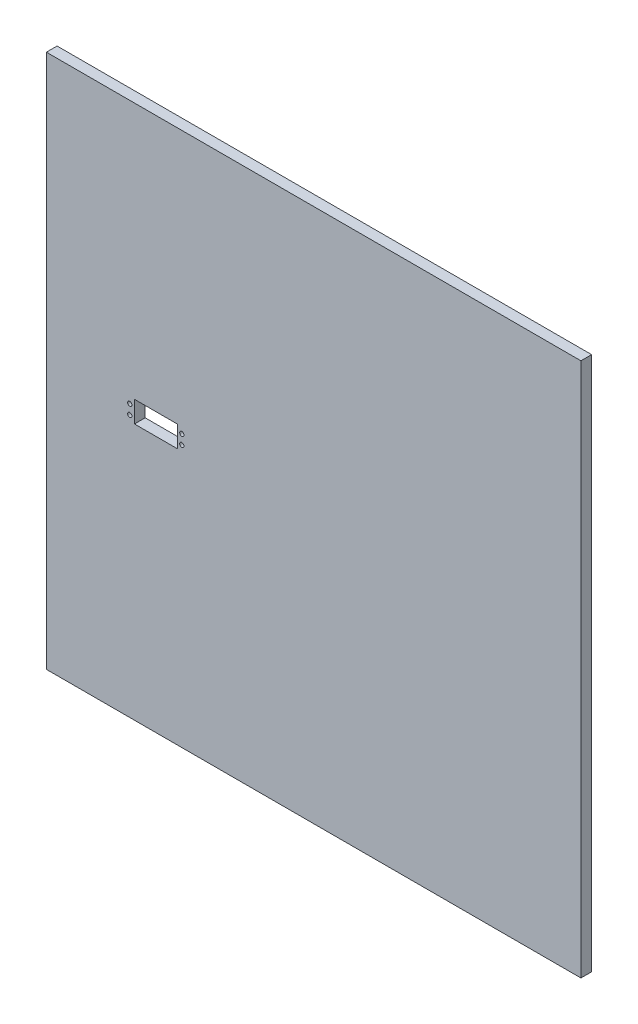
from build123d import *

# Parameters (mm, degrees)
CROQUIS1_W              = 500
CROQUIS1_H              = 500
CROQUIS1_R              = 2
CROQUIS1_W_2            = 40.3
CROQUIS1_H_2            = 20
SALIENTE_EXTRUIR1_DEPTH = 10


with BuildPart() as part:
    # Croquis1 → Saliente-Extruir1 (new body)
    with BuildSketch(Plane.XY):
        Rectangle(CROQUIS1_W, CROQUIS1_H)
        with Locations((-172.019654713, -4.841914395)):
            Circle(CROQUIS1_R, mode=Mode.SUBTRACT)
        with Locations((-172.019654713, 4.158085605)):
            Circle(CROQUIS1_R, mode=Mode.SUBTRACT)
        with Locations((-123.313117324, 4.158085605)):
            Circle(CROQUIS1_R, mode=Mode.SUBTRACT)
        with Locations((-123.313117324, -4.841914395)):
            Circle(CROQUIS1_R, mode=Mode.SUBTRACT)
        with Locations((-147.45, 0)):
            Rectangle(CROQUIS1_W_2, CROQUIS1_H_2, mode=Mode.SUBTRACT)
    extrude(amount=SALIENTE_EXTRUIR1_DEPTH)


solid = part.part
